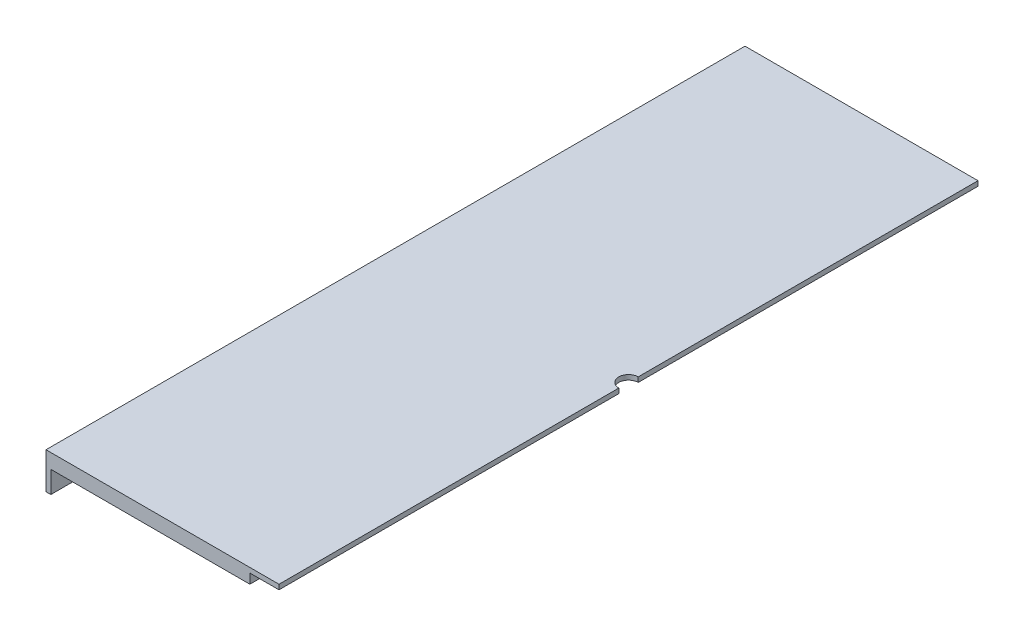
from build123d import *

# Parameters (mm, degrees)
SKETCH1_W           = 152.4
SKETCH1_H           = 457.2
BOSS_EXTRUDE1_DEPTH = 3.175
SKETCH2_W           = 3.175
SKETCH2_H           = 457.2
BOSS_EXTRUDE2_DEPTH = 23.8125
SKETCH3_W           = 133.35
SKETCH3_H           = 3.175
BOSS_EXTRUDE3_DEPTH = 6.35
SKETCH9_W           = 3.175
SKETCH9_H           = 457.2
BOSS_EXTRUDE4_DEPTH = 6.35
SKETCH11_R          = 6.35
CUT_EXTRUDE1_DEPTH  = 483.519051599


with BuildPart() as part:
    # Sketch1 → Boss-Extrude1 (new body)
    with BuildSketch(Plane(origin=(0, 0, 0), x_dir=(1, 0, 0), z_dir=(0, 1, 0))):
        with Locations((76.2, 228.6)):
            Rectangle(SKETCH1_W, SKETCH1_H)
    extrude(amount=BOSS_EXTRUDE1_DEPTH)

    # Sketch2 → Boss-Extrude2 (add)
    with BuildSketch(Plane(origin=(0, 3.175, 0), x_dir=(1, 0, 0), z_dir=(0, 1, 0))):
        with Locations((1.5875, 228.6)):
            Rectangle(SKETCH2_W, SKETCH2_H)
    extrude(amount=-BOSS_EXTRUDE2_DEPTH)

    # Sketch3 → Boss-Extrude3 (add)
    with BuildSketch(Plane.XZ):
        with Locations((66.675, -107.95)):
            Rectangle(SKETCH3_W, SKETCH3_H)
        with Locations((66.675, -228.6)):
            Rectangle(SKETCH3_W, SKETCH3_H)
        with Locations((66.675, -349.25)):
            Rectangle(SKETCH3_W, SKETCH3_H)
        with Locations((66.675, -1.5875)):
            Rectangle(SKETCH3_W, SKETCH3_H)
        with Locations((66.675, -455.6125)):
            Rectangle(SKETCH3_W, SKETCH3_H)
    extrude(amount=BOSS_EXTRUDE3_DEPTH)

    # Sketch9 → Boss-Extrude4 (add)
    with BuildSketch(Plane.XZ):
        with Locations((131.7625, -228.6)):
            Rectangle(SKETCH9_W, SKETCH9_H)
    extrude(amount=BOSS_EXTRUDE4_DEPTH)

    # Sketch11 → Cut-Extrude1 (cut, through all)
    with BuildSketch(Plane(origin=(0, 3.175, 0), x_dir=(1, 0, 0), z_dir=(0, 1, 0))):
        with Locations((152.4, 228.6)):
            Circle(SKETCH11_R)
    extrude(amount=-CUT_EXTRUDE1_DEPTH, mode=Mode.SUBTRACT)


solid = part.part
